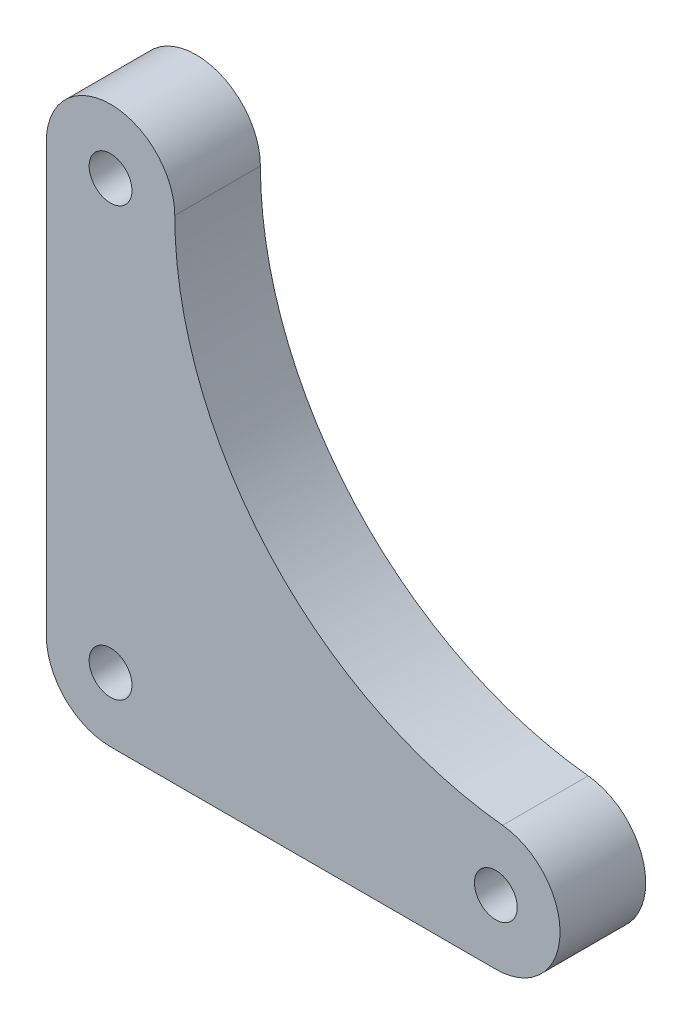
from build123d import *

# Parameters (mm, degrees)
SKETCH1_R           = 2.5
BOSS_EXTRUDE1_DEPTH = 10


with BuildPart() as part:
    # Sketch1 → Boss-Extrude1 (new body)
    with BuildSketch(Plane.XY):
        with BuildLine():
            Line((-7.5, 0), (-7.5, 50))
            ThreePointArc((-7.5, 50), (0, 57.5), (7.5, 50))
            ThreePointArc((7.5, 50), (18.481305966, 21.383175369), (45.787292818, 7.458563536))
            ThreePointArc((45.787292818, 7.458563536), (52.48963372, -0.394191248), (45, -7.5))
            Line((45, -7.5), (0, -7.5))
            ThreePointArc((0, -7.5), (-5.303300859, -5.303300859), (-7.5, 0))
        make_face()
        Circle(SKETCH1_R, mode=Mode.SUBTRACT)
        with Locations((45, 0)):
            Circle(SKETCH1_R, mode=Mode.SUBTRACT)
        with Locations((0, 50)):
            Circle(SKETCH1_R, mode=Mode.SUBTRACT)
    extrude(amount=BOSS_EXTRUDE1_DEPTH)


solid = part.part
